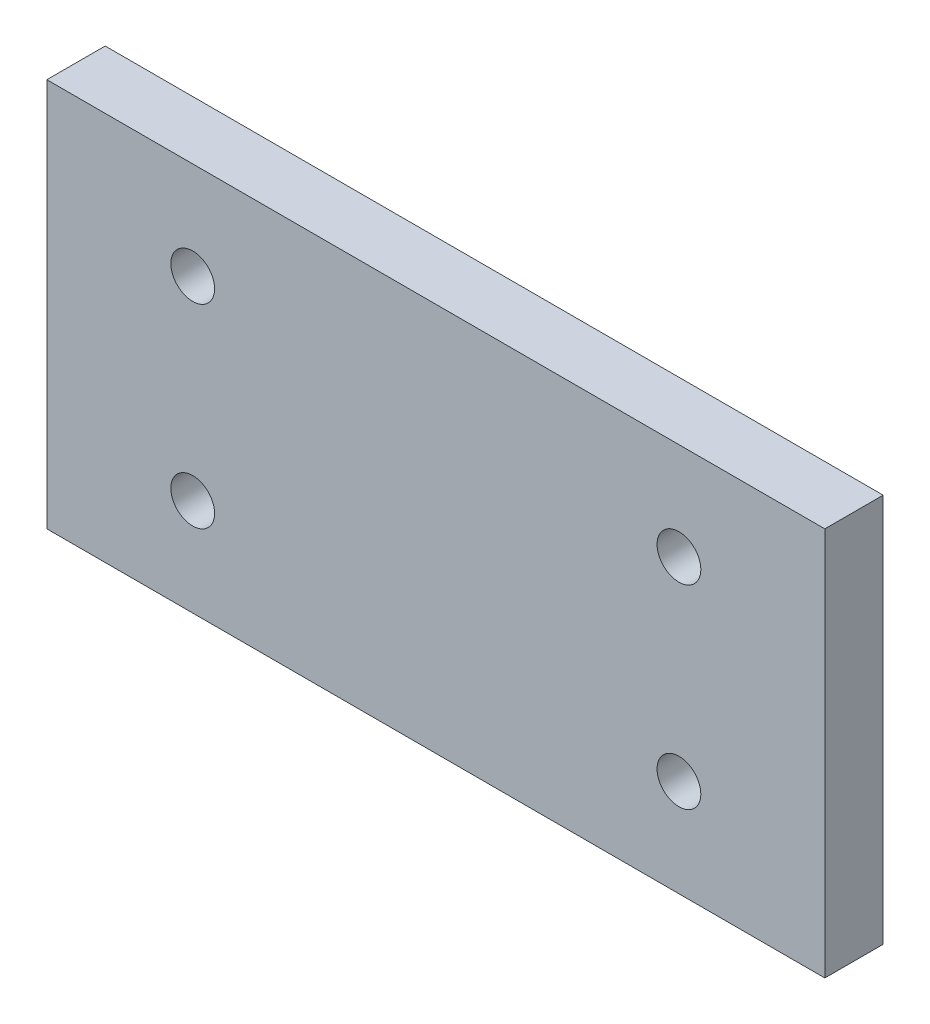
from build123d import *

# Parameters (mm, degrees)
SKETCH_1_W                = 80
SKETCH_1_H                = 40
EXTRUDE_228_DEPTH         = 6
CUT_EXTRUDE_M4_DEPTH      = 46.122056691
CUT_EXTRUDE_M4_DEPTH_BACK = 46.122056691
SKETCH_2_R                = 2.25


with BuildPart() as part:
    # 草图1 → Extrude 228 (new body)
    with BuildSketch(Plane.XY):
        Rectangle(SKETCH_1_W, SKETCH_1_H)
    extrude(amount=EXTRUDE_228_DEPTH)

    # 草图2 → 拼接M4孔 (cut, two sides: drawn at the far end of the back side and taken through both)
    with BuildSketch(Plane.XY.offset(-CUT_EXTRUDE_M4_DEPTH_BACK)):
        with Locations((-25, -10)):
            Circle(SKETCH_2_R)
        with Locations((-25, 10)):
            Circle(SKETCH_2_R)
        with Locations((25, -10)):
            Circle(SKETCH_2_R)
        with Locations((25, 10)):
            Circle(SKETCH_2_R)
    extrude(amount=CUT_EXTRUDE_M4_DEPTH + CUT_EXTRUDE_M4_DEPTH_BACK, mode=Mode.SUBTRACT)


solid = part.part
